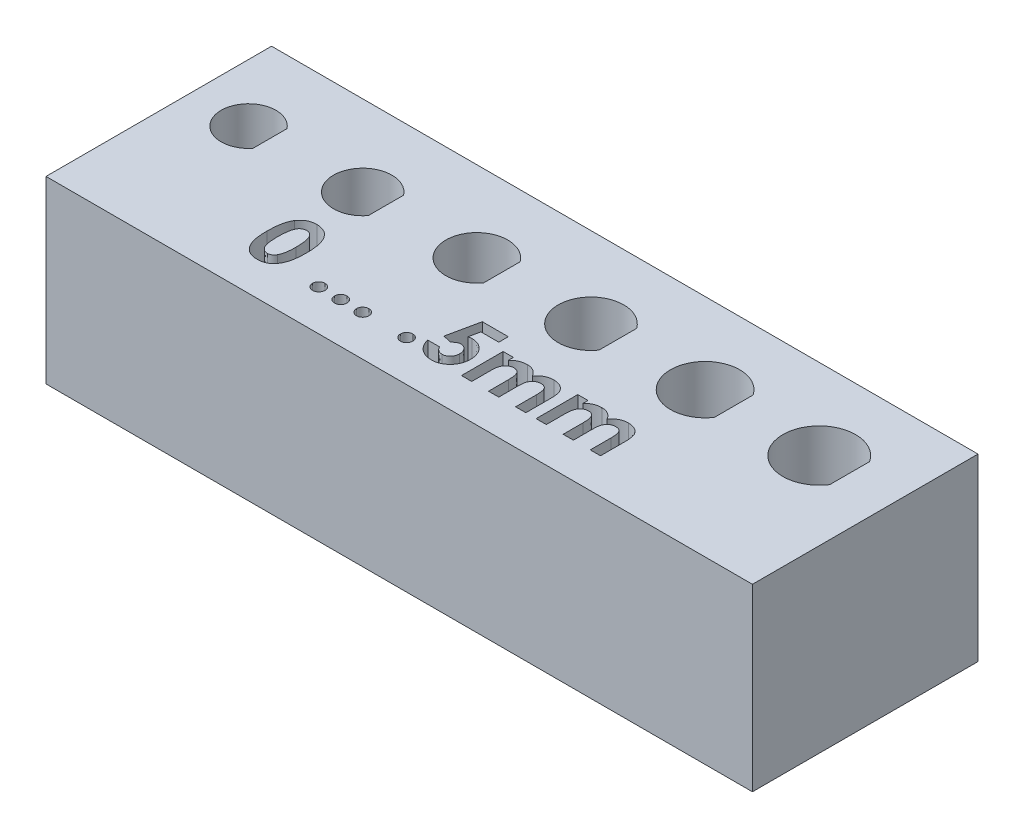
from build123d import *

# Parameters (mm, degrees)
SKETCH1_W           = 39.304218045
SKETCH1_H           = 12.549042639
BOSS_EXTRUDE1_DEPTH = 10
CUT_EXTRUDE1_DEPTH  = 2.5


with BuildPart() as part:
    # Sketch1 → Boss-Extrude1 (new body)
    with BuildSketch(Plane(origin=(0, 0, 0), x_dir=(1, 0, 0), z_dir=(0, 1, 0))):
        with Locations((16.442238917, -1.785688737)):
            Rectangle(SKETCH1_W, SKETCH1_H)
        with BuildLine():
            Line((1.193877106, 0.947224078), (1.193877106, -0.947224078))
            ThreePointArc((1.193877106, -0.947224078), (-1.524, 0), (1.193877106, 0.947224078))
        make_face(mode=Mode.SUBTRACT)
        with BuildLine():
            Line((14.093877106, 1.014535663), (14.093877106, -1.014535663))
            ThreePointArc((14.093877106, -1.014535663), (10.976, 0), (14.093877106, 1.014535663))
        make_face(mode=Mode.SUBTRACT)
        with BuildLine():
            Line((7.643877106, 0.981457097), (7.643877106, -0.981457097))
            ThreePointArc((7.643877106, -0.981457097), (4.726, 0), (7.643877106, 0.981457097))
        make_face(mode=Mode.SUBTRACT)
        with BuildLine():
            Line((20.543877106, 1.046569248), (20.543877106, -1.046569248))
            ThreePointArc((20.543877106, -1.046569248), (17.226, 0), (20.543877106, 1.046569248))
        make_face(mode=Mode.SUBTRACT)
        with BuildLine():
            Line((26.993877106, 1.077651043), (26.993877106, -1.077651043))
            ThreePointArc((26.993877106, -1.077651043), (23.476, 0), (26.993877106, 1.077651043))
        make_face(mode=Mode.SUBTRACT)
        with BuildLine():
            Line((33.443877106, 1.107861159), (33.443877106, -1.107861159))
            ThreePointArc((33.443877106, -1.107861159), (29.726, 0), (33.443877106, 1.107861159))
        make_face(mode=Mode.SUBTRACT)
    extrude(amount=BOSS_EXTRUDE1_DEPTH)

    # Sketch2 → Cut-Extrude1 (cut)
    # profile 1 of 8: a face of its own
    with BuildSketch(Plane(origin=(0, 10, 0), x_dir=(1, 0, 0), z_dir=(0, 1, 0))):
        with BuildLine():
            add(Edge.make_bspline(
                [(6.638092356, -2.842143726), (6.665676516, -2.842553221), (6.719914345, -2.843358396), (6.799796457, -2.852079107), (6.876745017, -2.865253668), (6.951061057, -2.883627587), (7.022209644, -2.907944814), (7.09070861, -2.937052118), (7.15574262, -2.972476237), (7.218141065, -3.012489599), (7.27787991, -3.057790397), (7.333523373, -3.109435645), (7.386087622, -3.166236985), (7.434434834, -3.229053151), (7.479635674, -3.297312763), (7.521541619, -3.371026645), (7.559831868, -3.450555576), (7.594935565, -3.536043075), (7.626325401, -3.62877056), (7.652765021, -3.729801656), (7.675441419, -3.839159436), (7.694581899, -3.957116108), (7.709049008, -4.083828465), (7.718800131, -4.219212324), (7.725491814, -4.363006686), (7.726037942, -4.461648437), (7.726318518, -4.512326018)],
                knots=[0, 0, 0, 0, 0.879237366, 1.728815576, 2.559023295, 3.367336655, 4.166867292, 4.954216142, 5.737608147, 6.525189134, 7.316157332, 8.124696809, 8.942788509, 9.781158001, 10.649253743, 11.551476218, 12.482711956, 13.461909668, 14.496590415, 15.601789533, 16.789733467, 18.056700938, 19.410929216, 20.8549011, 22.384193279, 24, 24, 24, 24], degree=3))
            add(Edge.make_bspline(
                [(7.726318518, -4.512326018), (7.726015291, -4.563637632), (7.725426128, -4.663335178), (7.719078307, -4.808444757), (7.708147059, -4.944811584), (7.694058077, -5.072421552), (7.674760027, -5.191207273), (7.652159328, -5.30147632), (7.625302366, -5.403188726), (7.592878559, -5.496115309), (7.557987346, -5.581752941), (7.519592357, -5.661126811), (7.478362809, -5.734451905), (7.435244386, -5.802834433), (7.387873176, -5.864258512), (7.33855487, -5.920812882), (7.28514206, -5.970343316), (7.229883633, -6.015402388), (7.170755249, -6.054342469), (7.108366682, -6.088398821), (7.041605654, -6.116022568), (6.971689104, -6.140048228), (6.897425291, -6.157296059), (6.819994256, -6.170981647), (6.738521819, -6.178545142), (6.683052102, -6.179483443), (6.654628814, -6.179964239)],
                knots=[0, 0, 0, 0, 1.643780988, 3.193836972, 4.651895693, 6.025988579, 7.305620092, 8.505800249, 9.631074763, 10.672816429, 11.65661981, 12.592235626, 13.49536222, 14.350718032, 15.179365177, 15.97804903, 16.751647189, 17.51006938, 18.259804725, 19.016521909, 19.783502495, 20.571750527, 21.382245291, 22.22305063, 23.089471752, 24, 24, 24, 24], degree=3))
            add(Edge.make_bspline(
                [(6.654628814, -6.179964239), (6.626206293, -6.179474169), (6.570526992, -6.178514129), (6.488834246, -6.171037884), (6.410992865, -6.157240619), (6.336141506, -6.139915812), (6.264801121, -6.116075728), (6.196629637, -6.087625498), (6.132151231, -6.05378164), (6.071187375, -6.014750832), (6.013946216, -5.969993239), (5.959538226, -5.919987594), (5.90808376, -5.864860647), (5.860365567, -5.803994931), (5.815602161, -5.738202877), (5.774260354, -5.666733172), (5.736364991, -5.589689873), (5.700730699, -5.50696559), (5.66976901, -5.416779365), (5.642214544, -5.318325845), (5.61964265, -5.21078434), (5.601488823, -5.094189398), (5.586994817, -4.968788031), (5.576212943, -4.834519711), (5.569829863, -4.691321899), (5.569246878, -4.59289491), (5.568946723, -4.542218846)],
                knots=[0, 0, 0, 0, 0.917216111, 1.796812873, 2.643793957, 3.46689424, 4.273913431, 5.068098542, 5.848489301, 6.620921603, 7.401012384, 8.190319798, 9.003608147, 9.831726257, 10.68377682, 11.569763213, 12.493818149, 13.453288342, 14.474581811, 15.568529029, 16.750744269, 18.018426408, 19.375425659, 20.823733699, 22.36466933, 24, 24, 24, 24], degree=3))
            add(Edge.make_bspline(
                [(5.568946723, -4.542218846), (5.569490426, -4.471808445), (5.570539508, -4.335950668), (5.58383425, -4.139675682), (5.603347558, -3.958253457), (5.632007985, -3.791987468), (5.667446208, -3.640261914), (5.712826697, -3.504076283), (5.764489082, -3.381546143), (5.808512072, -3.30895855), (5.82971395, -3.273999695)],
                knots=[0, 0, 0, 0, 1.288568992, 2.486310467, 3.599230591, 4.627010532, 5.572937695, 6.447898582, 7.252493626, 8, 8, 8, 8], degree=3))
            add(Edge.make_bspline(
                [(5.82971395, -3.273999695), (5.854366484, -3.239656127), (5.902567047, -3.172507684), (5.986847077, -3.08435433), (6.077394996, -3.008961265), (6.176070607, -2.948034702), (6.281313314, -2.899988009), (6.394026679, -2.866053171), (6.51379447, -2.846281153), (6.59604101, -2.843543463), (6.638092356, -2.842143726)],
                knots=[0, 0, 0, 0, 1.058512271, 2.069600068, 3.047294572, 4.004278952, 4.967380941, 5.939006123, 6.946246673, 8, 8, 8, 8], degree=3))
        make_face()
        with BuildLine():
            add(Edge.make_bspline(
                [(6.652084744, -3.412015521), (6.627148434, -3.413197452), (6.57826003, -3.415514665), (6.507320628, -3.435184536), (6.4404292, -3.465565711), (6.389546677, -3.502124705), (6.351461615, -3.537170885), (6.324851309, -3.568886538), (6.299189863, -3.604278922), (6.276524382, -3.644945111), (6.255122251, -3.689423923), (6.234205918, -3.737917264), (6.217060017, -3.791616235), (6.200214624, -3.849606337), (6.185456488, -3.913490841), (6.173092406, -3.983791932), (6.162046185, -4.060966786), (6.154341314, -4.145065952), (6.147158062, -4.236001441), (6.142008767, -4.333975823), (6.139855976, -4.438962665), (6.139171669, -4.511265545), (6.138818518, -4.548579022)],
                knots=[0, 0, 0, 0, 1.076674018, 2.110852608, 3.161083442, 4.239746716, 4.804137807, 5.395870207, 6.026861976, 6.692161227, 7.405688833, 8.16177676, 8.973626916, 9.841385931, 10.773283133, 11.807421078, 12.927755683, 14.143907515, 15.458935494, 16.872852025, 18.386167141, 20, 20, 20, 20], degree=3))
            add(Edge.make_bspline(
                [(6.138818518, -4.548579022), (6.139399762, -4.596920436), (6.140514341, -4.68961868), (6.146351986, -4.822921983), (6.158053061, -4.944238722), (6.172606835, -5.054391107), (6.193048206, -5.152664769), (6.216567326, -5.239989469), (6.245611348, -5.315252028), (6.279177312, -5.379540912), (6.31635313, -5.434231332), (6.356709115, -5.480718436), (6.398871291, -5.520974074), (6.444155677, -5.553673233), (6.492454238, -5.578732361), (6.543363769, -5.596757083), (6.596916623, -5.607790766), (6.633589065, -5.609320783), (6.652084744, -5.610092444)],
                knots=[0, 0, 0, 0, 1.771748488, 3.397459088, 4.888034009, 6.237357457, 7.467047327, 8.564189669, 9.548206622, 10.417051504, 11.216568818, 11.965764335, 12.669334354, 13.348544111, 14.005342236, 14.656555988, 15.322436492, 16, 16, 16, 16], degree=3))
            add(Edge.make_bspline(
                [(6.652084744, -5.610092444), (6.669945709, -5.609564416), (6.704915259, -5.608530603), (6.755908694, -5.59791865), (6.80413171, -5.580665919), (6.849438705, -5.556260721), (6.891991738, -5.525225777), (6.931582835, -5.487424707), (6.967913408, -5.442480722), (6.989079765, -5.409125638), (6.999986386, -5.391938397)],
                knots=[0, 0, 0, 0, 0.992283464, 1.942767638, 2.88273346, 3.832339453, 4.79467288, 5.803907806, 6.868395428, 8, 8, 8, 8], degree=3))
            add(Edge.make_bspline(
                [(6.999986386, -5.391938397), (7.012827096, -5.368452582), (7.039753023, -5.319204732), (7.070911752, -5.236100822), (7.097139434, -5.142373346), (7.119713216, -5.037730616), (7.135152306, -4.921759908), (7.148448431, -4.795196603), (7.154861483, -4.657403378), (7.155904601, -4.561939734), (7.156446723, -4.512326018)],
                knots=[0, 0, 0, 0, 0.710965849, 1.490837728, 2.352621235, 3.297892224, 4.334225155, 5.461620853, 6.680770821, 8, 8, 8, 8], degree=3))
            add(Edge.make_bspline(
                [(7.156446723, -4.512326018), (7.156237313, -4.46228163), (7.155834234, -4.365954727), (7.148438909, -4.227666125), (7.138140354, -4.101362439), (7.12307654, -3.987325653), (7.103694206, -3.885278935), (7.079805406, -3.795228956), (7.051642288, -3.716998246), (7.018244187, -3.65066481), (6.981253714, -3.594290489), (6.941987199, -3.545925695), (6.900278605, -3.504633053), (6.856197683, -3.470257174), (6.808724166, -3.443991424), (6.758764858, -3.425445631), (6.70621734, -3.414226049), (6.670372493, -3.412762309), (6.652084744, -3.412015521)],
                knots=[0, 0, 0, 0, 1.793836731, 3.452829483, 4.963243077, 6.335886805, 7.574563692, 8.684454726, 9.672768357, 10.54971625, 11.340229787, 12.085688095, 12.778991901, 13.440269426, 14.083255152, 14.715733572, 15.344777694, 16, 16, 16, 16], degree=3))
        make_face(mode=Mode.SUBTRACT)
    # profile 2 of 8: a face of its own
    with BuildSketch(Plane(origin=(0, 10, 0), x_dir=(1, 0, 0), z_dir=(0, 1, 0))):
        with BuildLine():
            add(Edge.make_bspline(
                [(9.700517236, -5.447271931), (9.723522284, -5.448533243), (9.768815252, -5.451016547), (9.834257415, -5.46954919), (9.893319343, -5.502845722), (9.946128599, -5.546275278), (9.990782776, -5.598526832), (10.023057805, -5.65811334), (10.043156275, -5.723303345), (10.045375161, -5.76873881), (10.046510825, -5.791993486)],
                knots=[0, 0, 0, 0, 1.016957001, 2.002212695, 2.9757545, 3.99499976, 5.013036768, 5.994806404, 6.97370641, 8, 8, 8, 8], degree=3))
            add(Edge.make_bspline(
                [(10.046510825, -5.791993486), (10.0453826, -5.815251896), (10.043178251, -5.860694658), (10.022918726, -5.92601169), (9.990831005, -5.986087946), (9.946125016, -6.038899409), (9.893538045, -6.083147436), (9.834121621, -6.116136925), (9.768939918, -6.135720877), (9.723544227, -6.138068352), (9.700517236, -6.139259111)],
                knots=[0, 0, 0, 0, 1.023218912, 1.999186227, 2.986238111, 4.008388923, 5.030539734, 6.0011649, 6.986089706, 8, 8, 8, 8], degree=3))
            add(Edge.make_bspline(
                [(9.700517236, -6.139259111), (9.677484788, -6.138078035), (9.63207834, -6.135749649), (9.566795317, -6.115971852), (9.506940235, -6.083367686), (9.454340051, -6.038845736), (9.409434336, -5.986274956), (9.378258899, -5.925822139), (9.357810662, -5.860719283), (9.355636447, -5.815260233), (9.354523646, -5.791993486)],
                knots=[0, 0, 0, 0, 1.013427518, 1.99788335, 2.976245624, 3.997909735, 5.019573847, 6.001765691, 6.977268297, 8, 8, 8, 8], degree=3))
            add(Edge.make_bspline(
                [(9.354523646, -5.791993486), (9.355643789, -5.768730328), (9.357832347, -5.723278291), (9.378120215, -5.658305075), (9.4094843, -5.598338806), (9.454336306, -5.546329062), (9.507160063, -5.502627191), (9.566658761, -5.469712001), (9.632202944, -5.450987563), (9.677506705, -5.44852348), (9.700517236, -5.447271931)],
                knots=[0, 0, 0, 0, 1.025808215, 2.00424526, 2.981110158, 3.998665696, 5.017428914, 5.998734231, 6.983523959, 8, 8, 8, 8], degree=3))
        make_face()
    # profile 3 of 8: a face of its own
    with BuildSketch(Plane(origin=(0, 10, 0), x_dir=(1, 0, 0), z_dir=(0, 1, 0))):
        with BuildLine():
            add(Edge.make_bspline(
                [(10.921671082, -5.447271931), (10.94467613, -5.448533243), (10.989969098, -5.451016547), (11.055411261, -5.46954919), (11.114473189, -5.502845722), (11.167282445, -5.546275278), (11.211936622, -5.598526832), (11.244211651, -5.65811334), (11.264310122, -5.723303345), (11.266529007, -5.76873881), (11.267664671, -5.791993486)],
                knots=[0, 0, 0, 0, 1.016957001, 2.002212695, 2.9757545, 3.99499976, 5.013036768, 5.994806404, 6.97370641, 8, 8, 8, 8], degree=3))
            add(Edge.make_bspline(
                [(11.267664671, -5.791993486), (11.266536446, -5.815251896), (11.264332097, -5.860694658), (11.244072572, -5.92601169), (11.211984851, -5.986087946), (11.167278863, -6.038899409), (11.114691891, -6.083147436), (11.055275467, -6.116136925), (10.990093764, -6.135720877), (10.944698073, -6.138068352), (10.921671082, -6.139259111)],
                knots=[0, 0, 0, 0, 1.023218912, 1.999186227, 2.986238111, 4.008388923, 5.030539734, 6.0011649, 6.986089706, 8, 8, 8, 8], degree=3))
            add(Edge.make_bspline(
                [(10.921671082, -6.139259111), (10.898638634, -6.138078035), (10.853232187, -6.135749649), (10.787949163, -6.115971852), (10.728094081, -6.083367686), (10.675493897, -6.038845736), (10.630588182, -5.986274956), (10.599412745, -5.925822139), (10.578964508, -5.860719283), (10.576790293, -5.815260233), (10.575677492, -5.791993486)],
                knots=[0, 0, 0, 0, 1.013427518, 1.99788335, 2.976245624, 3.997909735, 5.019573847, 6.001765691, 6.977268297, 8, 8, 8, 8], degree=3))
            add(Edge.make_bspline(
                [(10.575677492, -5.791993486), (10.576797635, -5.768730328), (10.578986193, -5.723278291), (10.599274061, -5.658305075), (10.630638146, -5.598338806), (10.675490152, -5.546329062), (10.728313909, -5.502627191), (10.787812608, -5.469712001), (10.85335679, -5.450987563), (10.898660551, -5.44852348), (10.921671082, -5.447271931)],
                knots=[0, 0, 0, 0, 1.025808215, 2.00424526, 2.981110158, 3.998665696, 5.017428914, 5.998734231, 6.983523959, 8, 8, 8, 8], degree=3))
        make_face()
    # profile 4 of 8: a face of its own
    with BuildSketch(Plane(origin=(0, 10, 0), x_dir=(1, 0, 0), z_dir=(0, 1, 0))):
        with BuildLine():
            add(Edge.make_bspline(
                [(12.142824928, -5.447271931), (12.165829977, -5.448533243), (12.211122944, -5.451016547), (12.276565107, -5.46954919), (12.335627036, -5.502845722), (12.388436291, -5.546275278), (12.433090468, -5.598526832), (12.465365498, -5.65811334), (12.485463968, -5.723303345), (12.487682853, -5.76873881), (12.488818518, -5.791993486)],
                knots=[0, 0, 0, 0, 1.016957001, 2.002212695, 2.9757545, 3.99499976, 5.013036768, 5.994806404, 6.97370641, 8, 8, 8, 8], degree=3))
            add(Edge.make_bspline(
                [(12.488818518, -5.791993486), (12.487690293, -5.815251896), (12.485485943, -5.860694658), (12.465226418, -5.92601169), (12.433138697, -5.986087946), (12.388432709, -6.038899409), (12.335845737, -6.083147436), (12.276429313, -6.116136925), (12.21124761, -6.135720877), (12.165851919, -6.138068352), (12.142824928, -6.139259111)],
                knots=[0, 0, 0, 0, 1.023218912, 1.999186227, 2.986238111, 4.008388923, 5.030539734, 6.0011649, 6.986089706, 8, 8, 8, 8], degree=3))
            add(Edge.make_bspline(
                [(12.142824928, -6.139259111), (12.11979248, -6.138078035), (12.074386033, -6.135749649), (12.009103009, -6.115971852), (11.949247927, -6.083367686), (11.896647743, -6.038845736), (11.851742028, -5.986274956), (11.820566591, -5.925822139), (11.800118354, -5.860719283), (11.79794414, -5.815260233), (11.796831338, -5.791993486)],
                knots=[0, 0, 0, 0, 1.013427518, 1.99788335, 2.976245624, 3.997909735, 5.019573847, 6.001765691, 6.977268297, 8, 8, 8, 8], degree=3))
            add(Edge.make_bspline(
                [(11.796831338, -5.791993486), (11.797951481, -5.768730328), (11.80014004, -5.723278291), (11.820427908, -5.658305075), (11.851791992, -5.598338806), (11.896643998, -5.546329062), (11.949467755, -5.502627191), (12.008966454, -5.469712001), (12.074510636, -5.450987563), (12.119814397, -5.44852348), (12.142824928, -5.447271931)],
                knots=[0, 0, 0, 0, 1.025808215, 2.00424526, 2.981110158, 3.998665696, 5.017428914, 5.998734231, 6.983523959, 8, 8, 8, 8], degree=3))
        make_face()
    # profile 5 of 8: a face of its own
    with BuildSketch(Plane(origin=(0, 10, 0), x_dir=(1, 0, 0), z_dir=(0, 1, 0))):
        with BuildLine():
            add(Edge.make_bspline(
                [(14.58513262, -5.447271931), (14.608137669, -5.448533243), (14.653430637, -5.451016547), (14.718872799, -5.46954919), (14.777934728, -5.502845722), (14.830743984, -5.546275278), (14.875398161, -5.598526832), (14.90767319, -5.65811334), (14.92777166, -5.723303345), (14.929990545, -5.76873881), (14.93112621, -5.791993486)],
                knots=[0, 0, 0, 0, 1.016957001, 2.002212695, 2.9757545, 3.99499976, 5.013036768, 5.994806404, 6.97370641, 8, 8, 8, 8], degree=3))
            add(Edge.make_bspline(
                [(14.93112621, -5.791993486), (14.929997985, -5.815251896), (14.927793636, -5.860694658), (14.90753411, -5.92601169), (14.87544639, -5.986087946), (14.830740401, -6.038899409), (14.778153429, -6.083147436), (14.718737005, -6.116136925), (14.653555303, -6.135720877), (14.608159611, -6.138068352), (14.58513262, -6.139259111)],
                knots=[0, 0, 0, 0, 1.023218912, 1.999186227, 2.986238111, 4.008388923, 5.030539734, 6.0011649, 6.986089706, 8, 8, 8, 8], degree=3))
            add(Edge.make_bspline(
                [(14.58513262, -6.139259111), (14.562100173, -6.138078035), (14.516693725, -6.135749649), (14.451410702, -6.115971852), (14.39155562, -6.083367686), (14.338955435, -6.038845736), (14.29404972, -5.986274956), (14.262874283, -5.925822139), (14.242426046, -5.860719283), (14.240251832, -5.815260233), (14.23913903, -5.791993486)],
                knots=[0, 0, 0, 0, 1.013427518, 1.99788335, 2.976245624, 3.997909735, 5.019573847, 6.001765691, 6.977268297, 8, 8, 8, 8], degree=3))
            add(Edge.make_bspline(
                [(14.23913903, -5.791993486), (14.240259173, -5.768730328), (14.242447732, -5.723278291), (14.2627356, -5.658305075), (14.294099684, -5.598338806), (14.33895169, -5.546329062), (14.391775448, -5.502627191), (14.451274146, -5.469712001), (14.516818328, -5.450987563), (14.562122089, -5.44852348), (14.58513262, -5.447271931)],
                knots=[0, 0, 0, 0, 1.025808215, 2.00424526, 2.981110158, 3.998665696, 5.017428914, 5.998734231, 6.983523959, 8, 8, 8, 8], degree=3))
        make_face()
    # profile 6 of 8: a face of its own
    with BuildSketch(Plane(origin=(0, 10, 0), x_dir=(1, 0, 0), z_dir=(0, 1, 0))):
        with BuildLine():
            Line((15.927765833, -2.923553982), (17.373433902, -2.923553982))
            Line((17.373433902, -2.923553982), (17.373433902, -3.452720649))
            Line((17.373433902, -3.452720649), (16.379338349, -3.452720649))
            Line((16.379338349, -3.452720649), (16.255314912, -4.05312129))
            add(Edge.make_bspline(
                [(16.255314912, -4.05312129), (16.272214881, -4.048414435), (16.305545091, -4.039131551), (16.355757095, -4.029821992), (16.404419524, -4.023787833), (16.436351513, -4.022982956), (16.451844359, -4.022592444)],
                knots=[0, 0, 0, 0, 1.05461699, 2.079921384, 3.068411212, 4, 4, 4, 4], degree=3))
            add(Edge.make_bspline(
                [(16.451844359, -4.022592444), (16.485604894, -4.023366047), (16.552154346, -4.024890989), (16.649507749, -4.039367664), (16.742729383, -4.062167988), (16.831533981, -4.094685954), (16.915834791, -4.137008927), (16.995734003, -4.18820786), (17.07132968, -4.248372678), (17.141278924, -4.317541048), (17.205551212, -4.393489484), (17.2614323, -4.475635755), (17.309158237, -4.562808533), (17.347117797, -4.655549683), (17.377078718, -4.753276728), (17.398729148, -4.856052295), (17.41153213, -4.963998188), (17.413258533, -5.037641953), (17.41413903, -5.075201619)],
                knots=[0, 0, 0, 0, 1.01440847, 1.999622559, 2.951875003, 3.895578053, 4.836219714, 5.782137149, 6.743708247, 7.735272588, 8.734977101, 9.730283169, 10.717124674, 11.717316708, 12.737475749, 13.78628267, 14.87096371, 16, 16, 16, 16], degree=3))
            add(Edge.make_bspline(
                [(17.41413903, -5.075201619), (17.413063049, -5.113187674), (17.410939822, -5.188145264), (17.397087712, -5.298359436), (17.37263849, -5.403919732), (17.339055038, -5.505108734), (17.294810989, -5.601182726), (17.241601465, -5.693136965), (17.178526836, -5.780288903), (17.106206081, -5.861745126), (17.027583933, -5.936197678), (16.943869905, -6.001693731), (16.855652113, -6.056808128), (16.762928428, -6.101349879), (16.666230836, -6.13659052), (16.565529988, -6.162244024), (16.460336491, -6.176954883), (16.388923774, -6.178950097), (16.352625609, -6.179964239)],
                knots=[0, 0, 0, 0, 1.06808661, 2.107647099, 3.116961351, 4.110378221, 5.100014249, 6.085620622, 7.093190682, 8.119403071, 9.144090782, 10.133780668, 11.103064255, 12.062861538, 13.020824475, 13.992378307, 14.979551724, 16, 16, 16, 16], degree=3))
            add(Edge.make_bspline(
                [(16.352625609, -6.179964239), (16.32016524, -6.179134608), (16.2561466, -6.177498402), (16.161849954, -6.16744142), (16.070937516, -6.14966058), (15.983891931, -6.123927102), (15.899797335, -6.092255064), (15.819625884, -6.052643196), (15.742937024, -6.00584576), (15.669948521, -5.952716811), (15.601846336, -5.892869111), (15.539689877, -5.827355491), (15.483102842, -5.75700172), (15.433296104, -5.680939845), (15.390425793, -5.599282243), (15.352407527, -5.512991268), (15.321289195, -5.421165768), (15.305497538, -5.357507229), (15.297472364, -5.325156546)],
                knots=[0, 0, 0, 0, 1.054957082, 2.080596141, 3.077793124, 4.061112343, 5.027190972, 5.994718051, 6.962465889, 7.943658696, 8.924948258, 9.904494768, 10.875059, 11.855380583, 12.854004648, 13.869083016, 14.917087635, 16, 16, 16, 16], degree=3))
            Line((15.297472364, -5.325156546), (15.948754415, -5.325156546))
            add(Edge.make_bspline(
                [(15.948754415, -5.325156546), (15.960659867, -5.347574252), (15.983796753, -5.391140505), (16.027808227, -5.448981251), (16.077076277, -5.498305355), (16.131156479, -5.539594722), (16.19039924, -5.570528014), (16.252390529, -5.593986392), (16.317909116, -5.607542119), (16.362530166, -5.60923672), (16.385062508, -5.610092444)],
                knots=[0, 0, 0, 0, 1.104910296, 2.147267069, 3.153527244, 4.136738762, 5.099945312, 6.05603338, 7.018353, 8, 8, 8, 8], degree=3))
            add(Edge.make_bspline(
                [(16.385062508, -5.610092444), (16.400767248, -5.609501559), (16.431666588, -5.608338983), (16.47719188, -5.602188662), (16.520647772, -5.590540095), (16.562357346, -5.574409538), (16.602432647, -5.55429291), (16.640299181, -5.528896979), (16.676615756, -5.499665321), (16.710829488, -5.466121894), (16.741817268, -5.428728776), (16.768990161, -5.388547321), (16.793286475, -5.34647037), (16.811283126, -5.300831149), (16.826020861, -5.252992463), (16.836874326, -5.202593448), (16.843360495, -5.149575244), (16.843960941, -5.113381202), (16.844267236, -5.094918165)],
                knots=[0, 0, 0, 0, 0.978869489, 1.925942215, 2.855067702, 3.774946051, 4.70828698, 5.642468714, 6.60995405, 7.609372294, 8.622401667, 9.629904756, 10.629323, 11.642352373, 12.678539694, 13.745912462, 14.850161547, 16, 16, 16, 16], degree=3))
            add(Edge.make_bspline(
                [(16.844267236, -5.094918165), (16.843911745, -5.076883697), (16.843219774, -5.041779168), (16.837495649, -4.990233144), (16.8272553, -4.941325296), (16.813302737, -4.894681027), (16.79544179, -4.850583582), (16.773614519, -4.808770472), (16.747727676, -4.769453049), (16.717642279, -4.733431774), (16.685559521, -4.700392037), (16.651092331, -4.671495747), (16.614551238, -4.647513832), (16.577071713, -4.626576922), (16.537157707, -4.611339496), (16.495706726, -4.600846042), (16.452762362, -4.593146368), (16.423470944, -4.592693984), (16.40859516, -4.592464239)],
                knots=[0, 0, 0, 0, 1.166249705, 2.270133367, 3.348514167, 4.393962215, 5.415026464, 6.420877785, 7.440098956, 8.453121383, 9.451844239, 10.415694839, 11.355045125, 12.27538808, 13.187007209, 14.108269027, 15.039275622, 16, 16, 16, 16], degree=3))
            add(Edge.make_bspline(
                [(16.40859516, -4.592464239), (16.392436602, -4.593077366), (16.360051385, -4.594306205), (16.311935058, -4.604304941), (16.264398881, -4.620486645), (16.217178502, -4.642811871), (16.170742667, -4.672028547), (16.12386591, -4.706296358), (16.078117298, -4.748105187), (16.049029058, -4.779244497), (16.033980777, -4.795353862)],
                knots=[0, 0, 0, 0, 0.88288272, 1.769486374, 2.674910571, 3.623812639, 4.617874466, 5.670434592, 6.794841017, 8, 8, 8, 8], degree=3))
            Line((16.033980777, -4.795353862), (15.554423486, -4.685322812))
            Line((15.554423486, -4.685322812), (15.927765833, -2.923553982))
        make_face()
    # profile 7 of 8: a face of its own
    with BuildSketch(Plane(origin=(0, 10, 0), x_dir=(1, 0, 0), z_dir=(0, 1, 0))):
        with BuildLine():
            Line((17.943305697, -3.778361675), (18.513177492, -3.778361675))
            Line((18.513177492, -3.778361675), (18.513177492, -4.055665361))
            add(Edge.make_bspline(
                [(18.513177492, -4.055665361), (18.5385251, -4.03008234), (18.588432456, -3.979711475), (18.671138709, -3.9149552), (18.757409705, -3.859580585), (18.848290913, -3.814751349), (18.94356004, -3.780520989), (19.042765561, -3.755437486), (19.146417036, -3.740639005), (19.216989681, -3.73866172), (19.252865994, -3.737656546)],
                knots=[0, 0, 0, 0, 1.041528618, 2.050684245, 3.032913108, 4.004406485, 4.976926473, 5.95771665, 6.961784757, 8, 8, 8, 8], degree=3))
            add(Edge.make_bspline(
                [(19.252865994, -3.737656546), (19.288789676, -3.738786506), (19.359504282, -3.741010795), (19.4626764, -3.761365127), (19.560415498, -3.794434037), (19.651646216, -3.841569706), (19.737027916, -3.899779807), (19.812778133, -3.972071657), (19.880962431, -4.055567474), (19.917307287, -4.11869121), (19.935948926, -4.151068005)],
                knots=[0, 0, 0, 0, 1.023965777, 2.015643508, 2.987309376, 3.958410333, 4.93654923, 5.924956801, 6.93568961, 8, 8, 8, 8], degree=3))
            add(Edge.make_bspline(
                [(19.935948926, -4.151068005), (19.959961767, -4.118603133), (20.007092235, -4.054883699), (20.090635282, -3.971690755), (20.180970241, -3.899772269), (20.279844886, -3.841139958), (20.384633448, -3.794594927), (20.494877386, -3.761487996), (20.609577192, -3.741044813), (20.687636704, -3.738795351), (20.727154856, -3.737656546)],
                knots=[0, 0, 0, 0, 1.041189987, 2.043563759, 3.033412161, 4.015238574, 5.00275396, 5.986226558, 6.980513695, 8, 8, 8, 8], degree=3))
            add(Edge.make_bspline(
                [(20.727154856, -3.737656546), (20.767972413, -3.73883902), (20.847460812, -3.741141777), (20.962650917, -3.763796876), (21.070540389, -3.798802403), (21.168744901, -3.849744012), (21.257544543, -3.910086366), (21.333212549, -3.981383375), (21.396010081, -4.061147182), (21.436899327, -4.135627115), (21.463333126, -4.201475905), (21.479294089, -4.258776691), (21.494222527, -4.322760265), (21.504947117, -4.394286657), (21.514958047, -4.472683575), (21.520769786, -4.558472227), (21.524720085, -4.651363612), (21.525139657, -4.715634655), (21.525356979, -4.748924575)],
                knots=[0, 0, 0, 0, 1.321991808, 2.574456155, 3.791773975, 4.987670122, 6.148905103, 7.262530793, 8.344737981, 9.427709016, 10.004683293, 10.642050061, 11.354108788, 12.133887687, 12.985666279, 13.916212488, 14.92067847, 16, 16, 16, 16], degree=3))
            Line((21.525356979, -4.748924575), (21.525356979, -6.098553982))
            Line((21.525356979, -6.098553982), (20.955485184, -6.098553982))
            Line((20.955485184, -6.098553982), (20.955485184, -4.933369687))
            add(Edge.make_bspline(
                [(20.955485184, -4.933369687), (20.955010874, -4.902203174), (20.954100478, -4.842381866), (20.950230035, -4.756579622), (20.941566327, -4.67876439), (20.931411351, -4.608505149), (20.916879385, -4.546174419), (20.89916029, -4.491621945), (20.878606249, -4.444769201), (20.853787863, -4.40562107), (20.825991241, -4.372652159), (20.79507151, -4.344391274), (20.761351054, -4.320279147), (20.724524148, -4.299726985), (20.683626022, -4.285827151), (20.640037331, -4.274920845), (20.593416981, -4.267493573), (20.561183682, -4.26705078), (20.544617796, -4.266823213)],
                knots=[0, 0, 0, 0, 1.669139205, 3.203761885, 4.596586177, 5.860166715, 7.002923539, 8.018877315, 8.928339525, 9.734594377, 10.491888885, 11.231098709, 11.971440889, 12.708030942, 13.480072485, 14.275788656, 15.113863979, 16, 16, 16, 16], degree=3))
            add(Edge.make_bspline(
                [(20.544617796, -4.266823213), (20.519090002, -4.267705775), (20.468996784, -4.269437628), (20.396000756, -4.285987416), (20.327310957, -4.313044549), (20.263184725, -4.349853383), (20.205001915, -4.39582692), (20.154106685, -4.450355918), (20.112074323, -4.513754634), (20.082978497, -4.572575925), (20.064797261, -4.625762191), (20.051972051, -4.671311957), (20.04197531, -4.722822005), (20.034150788, -4.779770657), (20.026644073, -4.842479849), (20.022961321, -4.910870285), (20.019192742, -4.984846952), (20.019241801, -5.035974346), (20.019267236, -5.062481266)],
                knots=[0, 0, 0, 0, 1.129913425, 2.217230253, 3.297175357, 4.391411011, 5.481605898, 6.571841268, 7.681894157, 8.841607612, 9.468549532, 10.170608623, 10.93710061, 11.791434153, 12.717934886, 13.734733707, 14.825576123, 16, 16, 16, 16], degree=3))
            Line((20.019267236, -5.062481266), (20.019267236, -6.098553982))
            Line((20.019267236, -6.098553982), (19.449395441, -6.098553982))
            Line((19.449395441, -6.098553982), (19.449395441, -4.986159151))
            add(Edge.make_bspline(
                [(19.449395441, -4.986159151), (19.449347594, -4.961351281), (19.449255553, -4.913628976), (19.446488973, -4.844717055), (19.442825482, -4.781086345), (19.437689693, -4.722559371), (19.431766572, -4.669208925), (19.423218143, -4.621326871), (19.41423723, -4.578649364), (19.398839333, -4.530168991), (19.377141716, -4.476444623), (19.344725159, -4.419472923), (19.305529115, -4.37177255), (19.26054426, -4.332972295), (19.209709444, -4.303409614), (19.154312471, -4.281418654), (19.09329557, -4.269548608), (19.051295615, -4.267750849), (19.029623806, -4.266823213)],
                knots=[0, 0, 0, 0, 1.256487322, 2.417074606, 3.49288742, 4.484586665, 5.393016842, 6.210437544, 6.947749329, 7.599905853, 8.784490193, 9.876739139, 10.906602197, 11.896672079, 12.869113195, 13.872201355, 14.902064413, 16, 16, 16, 16], degree=3))
            add(Edge.make_bspline(
                [(19.029623806, -4.266823213), (19.005136527, -4.267654354), (18.956639266, -4.269300435), (18.885995596, -4.286980692), (18.818453696, -4.313541377), (18.75549942, -4.351376864), (18.698193138, -4.398432299), (18.647807477, -4.454512329), (18.605996011, -4.519550435), (18.576771034, -4.579994227), (18.558854902, -4.634507418), (18.545684841, -4.681239926), (18.536060042, -4.733884341), (18.528029634, -4.791849559), (18.520567362, -4.855204002), (18.516869372, -4.924226277), (18.513104516, -4.99883988), (18.51315258, -5.050390866), (18.513177492, -5.077109671)],
                knots=[0, 0, 0, 0, 1.07893236, 2.136834559, 3.195274846, 4.273923004, 5.364443877, 6.458052972, 7.587287137, 8.767908, 9.410170275, 10.118584836, 10.909717261, 11.770069756, 12.702352573, 13.724628867, 14.820678298, 16, 16, 16, 16], degree=3))
            Line((18.513177492, -5.077109671), (18.513177492, -6.098553982))
            Line((18.513177492, -6.098553982), (17.943305697, -6.098553982))
            Line((17.943305697, -6.098553982), (17.943305697, -3.778361675))
        make_face()
    # profile 8 of 8: a face of its own
    with BuildSketch(Plane(origin=(0, 10, 0), x_dir=(1, 0, 0), z_dir=(0, 1, 0))):
        with BuildLine():
            Line((22.095228774, -3.778361675), (22.665100569, -3.778361675))
            Line((22.665100569, -3.778361675), (22.665100569, -4.055665361))
            add(Edge.make_bspline(
                [(22.665100569, -4.055665361), (22.690448177, -4.03008234), (22.740355533, -3.979711475), (22.823061786, -3.9149552), (22.909332782, -3.859580585), (23.00021399, -3.814751349), (23.095483117, -3.780520989), (23.194688637, -3.755437486), (23.298340112, -3.740639005), (23.368912758, -3.73866172), (23.40478907, -3.737656546)],
                knots=[0, 0, 0, 0, 1.041528618, 2.050684245, 3.032913108, 4.004406485, 4.976926473, 5.95771665, 6.961784757, 8, 8, 8, 8], degree=3))
            add(Edge.make_bspline(
                [(23.40478907, -3.737656546), (23.440712753, -3.738786506), (23.511427359, -3.741010795), (23.614599477, -3.761365127), (23.712338575, -3.794434037), (23.803569293, -3.841569706), (23.888950993, -3.899779807), (23.96470121, -3.972071657), (24.032885508, -4.055567474), (24.069230364, -4.11869121), (24.087872003, -4.151068005)],
                knots=[0, 0, 0, 0, 1.023965777, 2.015643508, 2.987309376, 3.958410333, 4.93654923, 5.924956801, 6.93568961, 8, 8, 8, 8], degree=3))
            add(Edge.make_bspline(
                [(24.087872003, -4.151068005), (24.111884844, -4.118603133), (24.159015312, -4.054883699), (24.242558359, -3.971690755), (24.332893318, -3.899772269), (24.431767963, -3.841139958), (24.536556525, -3.794594927), (24.646800463, -3.761487996), (24.761500269, -3.741044813), (24.839559781, -3.738795351), (24.879077933, -3.737656546)],
                knots=[0, 0, 0, 0, 1.041189987, 2.043563759, 3.033412161, 4.015238574, 5.00275396, 5.986226558, 6.980513695, 8, 8, 8, 8], degree=3))
            add(Edge.make_bspline(
                [(24.879077933, -3.737656546), (24.91989549, -3.73883902), (24.999383889, -3.741141777), (25.114573994, -3.763796876), (25.222463466, -3.798802403), (25.320667978, -3.849744012), (25.40946762, -3.910086366), (25.485135626, -3.981383375), (25.547933158, -4.061147182), (25.588822404, -4.135627115), (25.615256203, -4.201475905), (25.631217166, -4.258776691), (25.646145604, -4.322760265), (25.656870193, -4.394286657), (25.666881124, -4.472683575), (25.672692863, -4.558472227), (25.676643162, -4.651363612), (25.677062734, -4.715634655), (25.677280056, -4.748924575)],
                knots=[0, 0, 0, 0, 1.321991808, 2.574456155, 3.791773975, 4.987670122, 6.148905103, 7.262530793, 8.344737981, 9.427709016, 10.004683293, 10.642050061, 11.354108788, 12.133887687, 12.985666279, 13.916212488, 14.92067847, 16, 16, 16, 16], degree=3))
            Line((25.677280056, -4.748924575), (25.677280056, -6.098553982))
            Line((25.677280056, -6.098553982), (25.107408261, -6.098553982))
            Line((25.107408261, -6.098553982), (25.107408261, -4.933369687))
            add(Edge.make_bspline(
                [(25.107408261, -4.933369687), (25.106933951, -4.902203174), (25.106023555, -4.842381866), (25.102153112, -4.756579622), (25.093489404, -4.67876439), (25.083334428, -4.608505149), (25.068802461, -4.546174419), (25.051083367, -4.491621945), (25.030529325, -4.444769201), (25.00571094, -4.40562107), (24.977914318, -4.372652159), (24.946994587, -4.344391274), (24.913274131, -4.320279147), (24.876447225, -4.299726985), (24.835549099, -4.285827151), (24.791960408, -4.274920845), (24.745340058, -4.267493573), (24.713106759, -4.26705078), (24.696540873, -4.266823213)],
                knots=[0, 0, 0, 0, 1.669139205, 3.203761885, 4.596586177, 5.860166715, 7.002923539, 8.018877315, 8.928339525, 9.734594377, 10.491888885, 11.231098709, 11.971440889, 12.708030942, 13.480072485, 14.275788656, 15.113863979, 16, 16, 16, 16], degree=3))
            add(Edge.make_bspline(
                [(24.696540873, -4.266823213), (24.671013079, -4.267705775), (24.620919861, -4.269437628), (24.547923833, -4.285987416), (24.479234033, -4.313044549), (24.415107802, -4.349853383), (24.356924992, -4.39582692), (24.306029762, -4.450355918), (24.2639974, -4.513754634), (24.234901574, -4.572575925), (24.216720337, -4.625762191), (24.203895128, -4.671311957), (24.193898386, -4.722822005), (24.186073865, -4.779770657), (24.17856715, -4.842479849), (24.174884398, -4.910870285), (24.171115819, -4.984846952), (24.171164878, -5.035974346), (24.171190312, -5.062481266)],
                knots=[0, 0, 0, 0, 1.129913425, 2.217230253, 3.297175357, 4.391411011, 5.481605898, 6.571841268, 7.681894157, 8.841607612, 9.468549532, 10.170608623, 10.93710061, 11.791434153, 12.717934886, 13.734733707, 14.825576123, 16, 16, 16, 16], degree=3))
            Line((24.171190312, -5.062481266), (24.171190312, -6.098553982))
            Line((24.171190312, -6.098553982), (23.601318518, -6.098553982))
            Line((23.601318518, -6.098553982), (23.601318518, -4.986159151))
            add(Edge.make_bspline(
                [(23.601318518, -4.986159151), (23.601270671, -4.961351281), (23.60117863, -4.913628976), (23.59841205, -4.844717055), (23.594748558, -4.781086345), (23.58961277, -4.722559371), (23.583689648, -4.669208925), (23.57514122, -4.621326871), (23.566160307, -4.578649364), (23.55076241, -4.530168991), (23.529064793, -4.476444623), (23.496648236, -4.419472923), (23.457452192, -4.37177255), (23.412467337, -4.332972295), (23.361632521, -4.303409614), (23.306235548, -4.281418654), (23.245218647, -4.269548608), (23.203218692, -4.267750849), (23.181546883, -4.266823213)],
                knots=[0, 0, 0, 0, 1.256487322, 2.417074606, 3.49288742, 4.484586665, 5.393016842, 6.210437544, 6.947749329, 7.599905853, 8.784490193, 9.876739139, 10.906602197, 11.896672079, 12.869113195, 13.872201355, 14.902064413, 16, 16, 16, 16], degree=3))
            add(Edge.make_bspline(
                [(23.181546883, -4.266823213), (23.157059604, -4.267654354), (23.108562343, -4.269300435), (23.037918673, -4.286980692), (22.970376773, -4.313541377), (22.907422497, -4.351376864), (22.850116214, -4.398432299), (22.799730554, -4.454512329), (22.757919088, -4.519550435), (22.728694111, -4.579994227), (22.710777979, -4.634507418), (22.697607918, -4.681239926), (22.687983119, -4.733884341), (22.679952711, -4.791849559), (22.672490439, -4.855204002), (22.668792448, -4.924226277), (22.665027593, -4.99883988), (22.665075657, -5.050390866), (22.665100569, -5.077109671)],
                knots=[0, 0, 0, 0, 1.07893236, 2.136834559, 3.195274846, 4.273923004, 5.364443877, 6.458052972, 7.587287137, 8.767908, 9.410170275, 10.118584836, 10.909717261, 11.770069756, 12.702352573, 13.724628867, 14.820678298, 16, 16, 16, 16], degree=3))
            Line((22.665100569, -5.077109671), (22.665100569, -6.098553982))
            Line((22.665100569, -6.098553982), (22.095228774, -6.098553982))
            Line((22.095228774, -6.098553982), (22.095228774, -3.778361675))
        make_face()
    extrude(amount=-CUT_EXTRUDE1_DEPTH, mode=Mode.SUBTRACT)


solid = part.part
